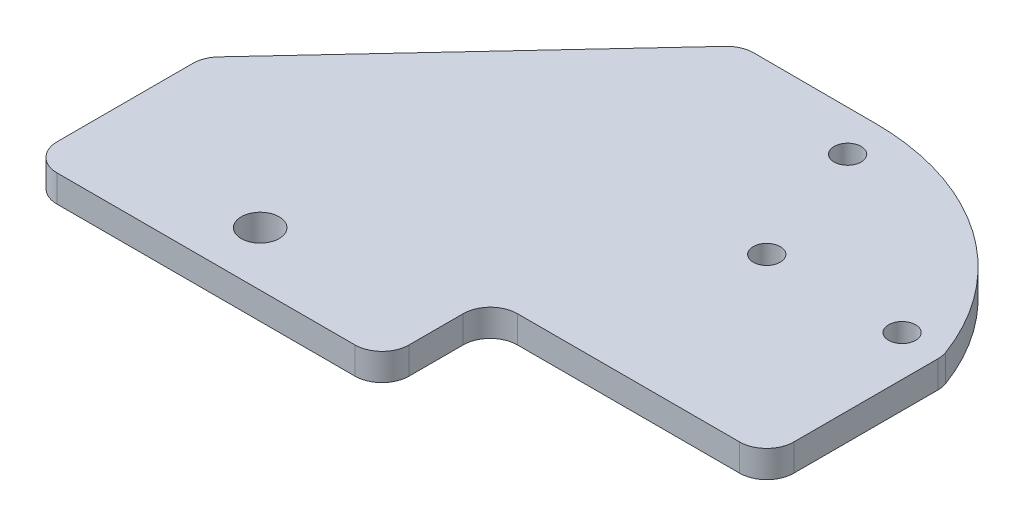
from build123d import *

# Parameters (mm, degrees)
BOSS_EXTRUDE1_DEPTH     = 10
CUT_EXTRUDE4_DEPTH      = 186.673146884
CUT_EXTRUDE4_DEPTH_BACK = 186.673146884
SKETCH2_R               = 5
SKETCH3_R               = 7
CUT_EXTRUDE5_DEPTH      = 186.673146884


with BuildPart() as part:
    # Sketch1 → Boss-Extrude1 (new body)
    with BuildSketch(Plane(origin=(0, 0, 0), x_dir=(1, 0, 0), z_dir=(0, 1, 0))):
        with BuildLine():
            Line((-1.545174458, 127), (10, 127))
            ThreePointArc((10, 127), (62.706174301, 110.445628071), (96.481761872, 66.728380632))
            ThreePointArc((96.481761872, 66.728380632), (96.94422721, 65.024977681), (97.1, 63.266799465))
            Line((97.1, 63.266799465), (97.1, 10))
            ThreePointArc((97.1, 10), (94.171067812, 2.928932188), (87.1, 0))
            Line((87.1, 0), (5, 0))
            ThreePointArc((5, 0), (-2.071067812, -2.928932188), (-5, -10))
            Line((-5, -10), (-5, -30))
            ThreePointArc((-5, -30), (-7.928932188, -37.071067812), (-15, -40))
            Line((-15, -40), (-125, -40))
            ThreePointArc((-125, -40), (-132.071067812, -37.071067812), (-135, -30))
            Line((-135, -30), (-135, 20.135444575))
            ThreePointArc((-135, 20.135444575), (-134.306211211, 23.795285131), (-132.321113421, 26.947294417))
            Line((-132.321113421, 26.947294417), (-42.119413536, 123.892601626))
            ThreePointArc((-42.119413536, 123.892601626), (-38.77974787, 126.253977703), (-34.774007346, 127.080722276))
            Line((-34.774007346, 127.080722276), (-1.545174458, 127))
        make_face()
    extrude(amount=BOSS_EXTRUDE1_DEPTH)

    # Sketch2 → Cut-Extrude4 (cut, two sides: drawn at the far end of the back side and taken through both)
    with BuildSketch(Plane(origin=(0, 0, 0), x_dir=(1, 0, 0), z_dir=(0, 1, 0)).offset(-CUT_EXTRUDE4_DEPTH_BACK)):
        with Locations(Location((14.998992834, 111.984631039, 0), (0, 0, 270))):
            Circle(SKETCH2_R)
        with Locations(Location((82.1, 65, 0), (0, 0, 270))):
            Circle(SKETCH2_R)
        with Locations(Location((32.1, 65, 0), (0, 0, 270))):
            Circle(SKETCH2_R)
    extrude(amount=CUT_EXTRUDE4_DEPTH + CUT_EXTRUDE4_DEPTH_BACK, mode=Mode.SUBTRACT)

    # Sketch3 → Cut-Extrude5 (cut, through all)
    with BuildSketch(Plane.XZ):
        with Locations(Location((-70, 20, 0), (0, 0, 270))):
            Circle(SKETCH3_R)
    extrude(amount=-CUT_EXTRUDE5_DEPTH, mode=Mode.SUBTRACT)


solid = part.part
